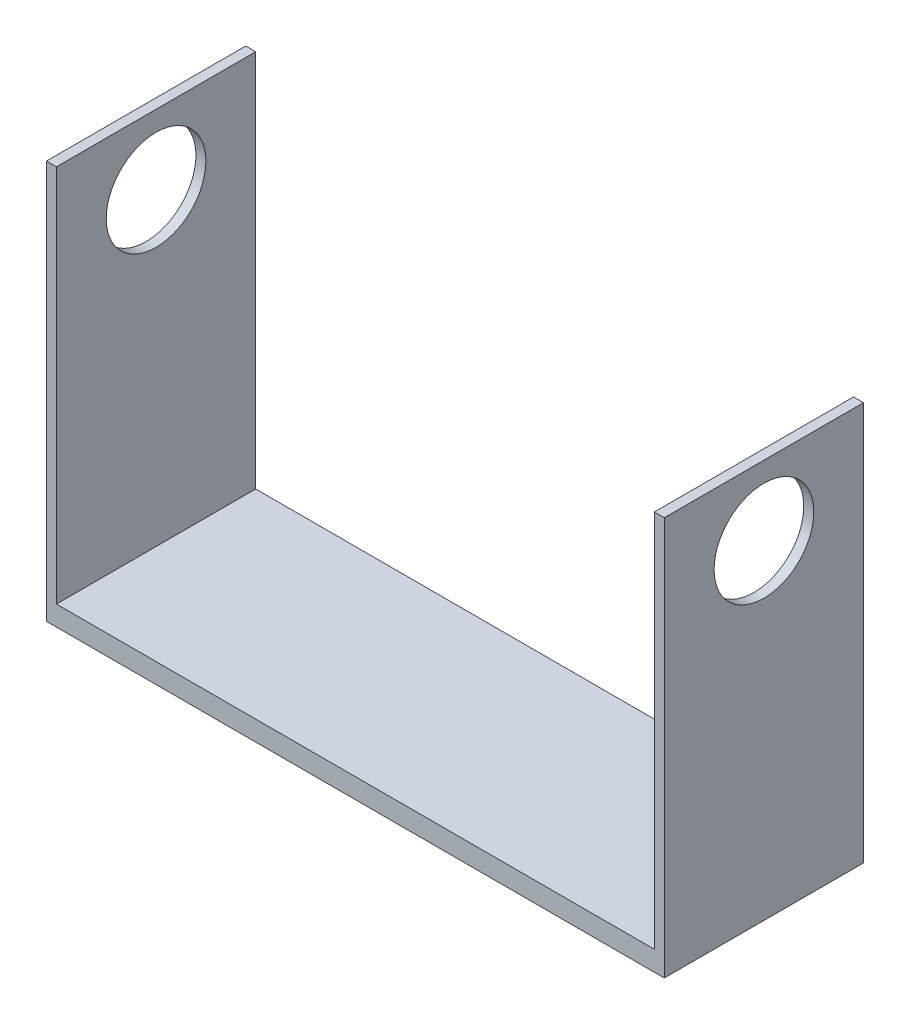
from build123d import *

# Parameters (mm, degrees)
SKETCH1_W           = 300
SKETCH1_H           = 100
BOSS_EXTRUDE1_DEPTH = 10
SKETCH2_W           = 100
SKETCH2_H           = 200
BOSS_EXTRUDE2_DEPTH = 5
SKETCH3_W           = 100
SKETCH3_H           = 200
BOSS_EXTRUDE3_DEPTH = 5
CUT_EXTRUDE1_REACH  = 374.29
SKETCH4_R           = 25


with BuildPart() as part:
    # Sketch1 → Boss-Extrude1 (new body)
    with BuildSketch(Plane(origin=(0, 0, 0), x_dir=(1, 0, 0), z_dir=(0, 1, 0))):
        Rectangle(SKETCH1_W, SKETCH1_H)
    extrude(amount=BOSS_EXTRUDE1_DEPTH)

    # Sketch2 → Boss-Extrude2 (add)
    with BuildSketch(Plane(origin=(150, 0, 0), x_dir=(0, 0, -1), z_dir=(1, 0, 0))):
        with Locations((0, 100)):
            Rectangle(SKETCH2_W, SKETCH2_H)
    extrude(amount=BOSS_EXTRUDE2_DEPTH)

    # Sketch3 → Boss-Extrude3 (add)
    with BuildSketch(Plane.ZY.offset(150)):
        with Locations((0, 100)):
            Rectangle(SKETCH3_W, SKETCH3_H)
    extrude(amount=BOSS_EXTRUDE3_DEPTH)

    # Cut-Extrude1: up to this face of the body (flat: up to its plane)
    cut_extrude1_end = Plane(part.part.faces().sort_by_distance((155, 100, 0))[0])
    # Sketch4 → Cut-Extrude1 (cut, up to the picked face)
    with BuildSketch(Plane.ZY.offset(155), mode=Mode.PRIVATE) as cut_extrude1_sk1:
        with Locations((0, 165)):
            Circle(SKETCH4_R)
    cut_extrude1_tool1 = split(extrude(cut_extrude1_sk1.sketch, amount=-CUT_EXTRUDE1_REACH, mode=Mode.PRIVATE), bisect_by=cut_extrude1_end, keep=Keep.BOTH, mode=Mode.PRIVATE)
    add(cut_extrude1_tool1.solids().sort_by(Axis((-155, 165, 0), (1, 0, 0)))[0], mode=Mode.SUBTRACT)


solid = part.part
